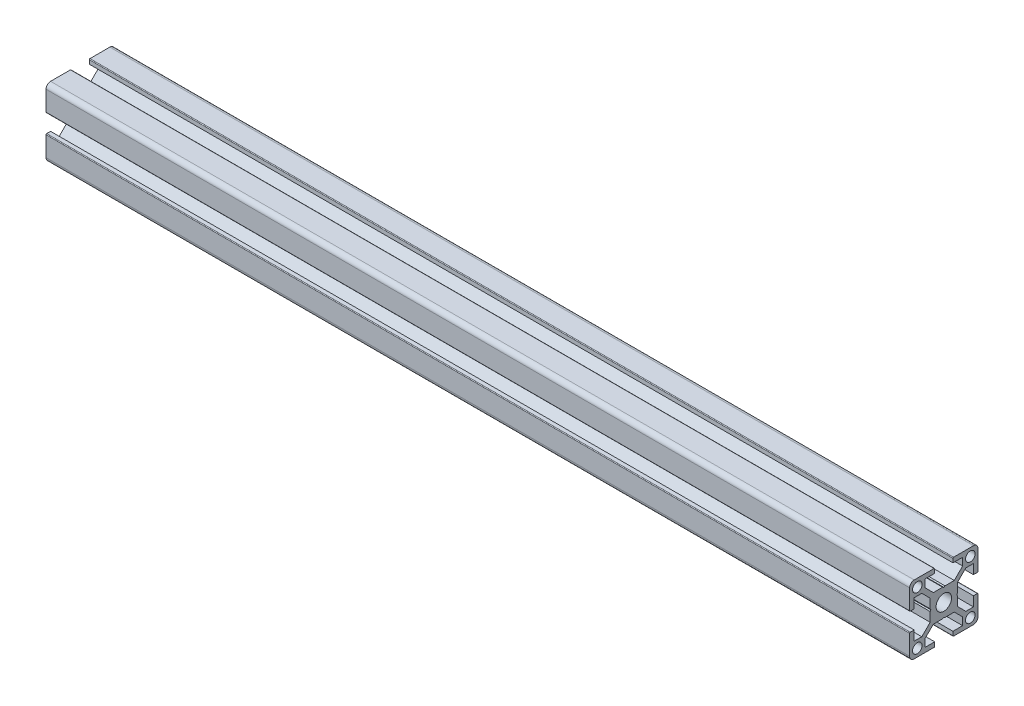
from build123d import *

# Parameters (mm, degrees)
SKETCH_1_R              = 2.1
SKETCH_1_R_2            = 3.4
F_30XS6_30X30S6_1_DEPTH = 379


with BuildPart() as part:
    # 草图1 → 30xs6 30X30S6(1) (new body)
    with BuildSketch(Plane.YZ):
        with BuildLine():
            Line((-14.7, 4), (-13, 4))
            Line((-13, 4), (-13, 8.25))
            Line((-13, 8.25), (-9.664213562, 8.25))
            Line((-9.664213562, 8.25), (-6, 4.585786438))
            Line((-6, 4.585786438), (-6, 0.519615242))
            Line((-6, 0.519615242), (-5.7, 0))
            Line((-5.7, 0), (-6, -0.519615242))
            Line((-6, -0.519615242), (-6, -4.585786438))
            Line((-6, -4.585786438), (-9.664213562, -8.25))
            Line((-9.664213562, -8.25), (-13, -8.25))
            Line((-13, -8.25), (-13, -4))
            Line((-13, -4), (-14.7, -4))
            ThreePointArc((-14.7, -4), (-14.912132034, -4.087867966), (-15, -4.3))
            Line((-15, -4.3), (-15, -13))
            ThreePointArc((-15, -13), (-14.414213562, -14.414213562), (-13, -15))
            Line((-13, -15), (-4.3, -15))
            ThreePointArc((-4.3, -15), (-4.087867966, -14.912132034), (-4, -14.7))
            Line((-4, -14.7), (-4, -13))
            Line((-4, -13), (-8.25, -13))
            Line((-8.25, -13), (-8.25, -9.664213562))
            Line((-8.25, -9.664213562), (-4.585786438, -6))
            Line((-4.585786438, -6), (-0.519615242, -6))
            Line((-0.519615242, -6), (0, -5.7))
            Line((0, -5.7), (0.519615242, -6))
            Line((0.519615242, -6), (4.585786438, -6))
            Line((4.585786438, -6), (8.25, -9.664213562))
            Line((8.25, -9.664213562), (8.25, -13))
            Line((8.25, -13), (4, -13))
            Line((4, -13), (4, -14.7))
            ThreePointArc((4, -14.7), (4.087867966, -14.912132034), (4.3, -15))
            Line((4.3, -15), (13, -15))
            ThreePointArc((13, -15), (14.414213562, -14.414213562), (15, -13))
            Line((15, -13), (15, -4.3))
            ThreePointArc((15, -4.3), (14.912132034, -4.087867966), (14.7, -4))
            Line((14.7, -4), (13, -4))
            Line((13, -4), (13, -8.25))
            Line((13, -8.25), (9.664213562, -8.25))
            Line((9.664213562, -8.25), (6, -4.585786438))
            Line((6, -4.585786438), (6, -0.519615242))
            Line((6, -0.519615242), (5.7, 0))
            Line((5.7, 0), (6, 0.519615242))
            Line((6, 0.519615242), (6, 4.585786438))
            Line((6, 4.585786438), (9.664213562, 8.25))
            Line((9.664213562, 8.25), (13, 8.25))
            Line((13, 8.25), (13, 4))
            Line((13, 4), (14.7, 4))
            ThreePointArc((14.7, 4), (14.912132034, 4.087867966), (15, 4.3))
            Line((15, 4.3), (15, 13))
            ThreePointArc((15, 13), (14.414213562, 14.414213562), (13, 15))
            Line((13, 15), (4.3, 15))
            ThreePointArc((4.3, 15), (4.087867966, 14.912132034), (4, 14.7))
            Line((4, 14.7), (4, 13))
            Line((4, 13), (8.25, 13))
            Line((8.25, 13), (8.25, 9.664213562))
            Line((8.25, 9.664213562), (4.585786438, 6))
            Line((4.585786438, 6), (0.519615242, 6))
            Line((0.519615242, 6), (0, 5.7))
            Line((0, 5.7), (-0.519615242, 6))
            Line((-0.519615242, 6), (-4.585786438, 6))
            Line((-4.585786438, 6), (-8.25, 9.664213562))
            Line((-8.25, 9.664213562), (-8.25, 13))
            Line((-8.25, 13), (-4, 13))
            Line((-4, 13), (-4, 14.7))
            ThreePointArc((-4, 14.7), (-4.087867966, 14.912132034), (-4.3, 15))
            Line((-4.3, 15), (-13, 15))
            ThreePointArc((-13, 15), (-14.414213562, 14.414213562), (-15, 13))
            Line((-15, 13), (-15, 4.3))
            ThreePointArc((-15, 4.3), (-14.912132034, 4.087867966), (-14.7, 4))
        make_face()
        with Locations((11.625, 11.625)):
            Circle(SKETCH_1_R, mode=Mode.SUBTRACT)
        with Locations((11.625, -11.625)):
            Circle(SKETCH_1_R, mode=Mode.SUBTRACT)
        Circle(SKETCH_1_R_2, mode=Mode.SUBTRACT)
        with Locations((-11.625, -11.625)):
            Circle(SKETCH_1_R, mode=Mode.SUBTRACT)
        with Locations((-11.625, 11.625)):
            Circle(SKETCH_1_R, mode=Mode.SUBTRACT)
    extrude(amount=F_30XS6_30X30S6_1_DEPTH)


solid = part.part
